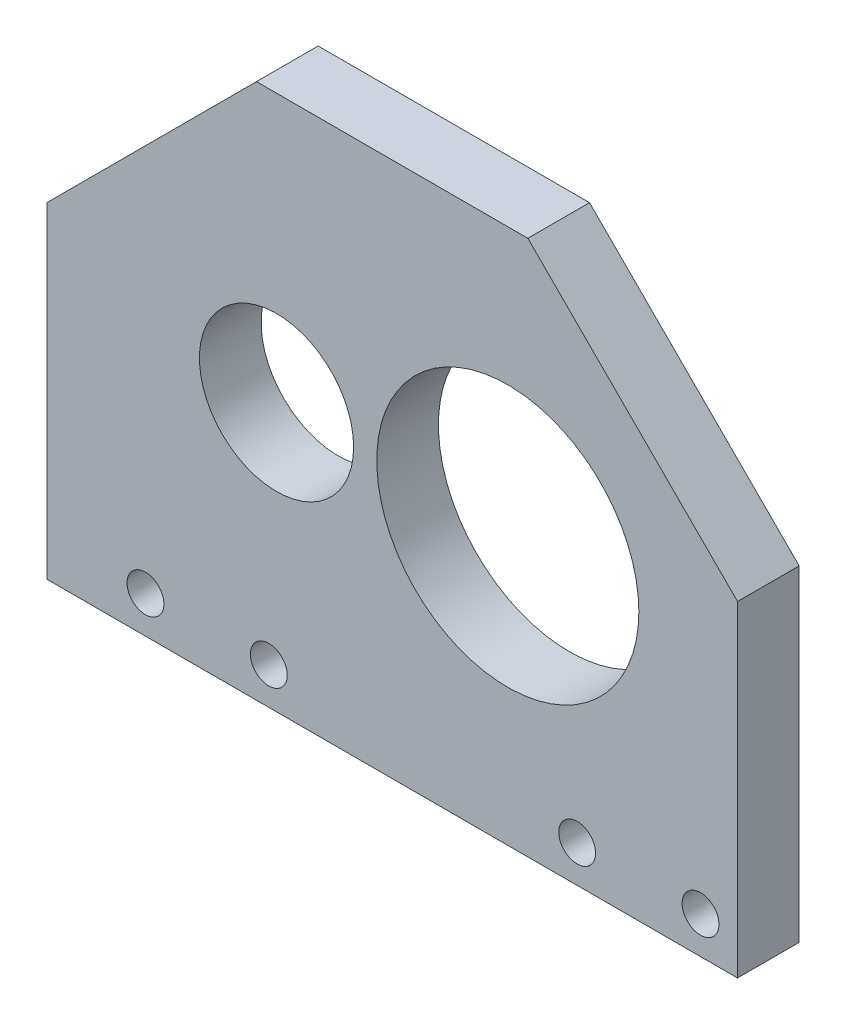
from build123d import *

# Parameters (mm, degrees)
SKETCH1_W             = 71.12
SKETCH1_H             = 55.16372
SKETCH1_R             = 13.49375
SKETCH1_R_2           = 7.9375
BOSS_EXTRUDE1_DEPTH   = 6.35
F_6_CLEARANCE_HOLE1_D = 3.7973
CUT_EXTRUDE1_DEPTH    = 46.448818478


with BuildPart() as part:
    # Sketch1 → Boss-Extrude1 (new body)
    with BuildSketch(Plane.XY):
        Rectangle(SKETCH1_W, SKETCH1_H)
        with Locations((11.90625, 0)):
            Circle(SKETCH1_R, mode=Mode.SUBTRACT)
        with Locations((-11.90625, 0)):
            Circle(SKETCH1_R_2, mode=Mode.SUBTRACT)
    extrude(amount=BOSS_EXTRUDE1_DEPTH)

    # #6 Clearance Hole1 (through all)
    with Locations(Plane.XY.offset(6.35)):
        with Locations((-25.4, -23.77186), (-12.7, -23.77186), (19.05, -23.77186), (31.75, -23.77186)):
            Hole(F_6_CLEARANCE_HOLE1_D / 2)

    # Sketch4 → Cut-Extrude1 (cut, through all)
    with BuildSketch(Plane.XY.offset(6.35)):
        Polygon((-35.56, 5.99186), (-13.97, 27.58186), (-35.56, 27.58186), align=None)
        Polygon((35.56, 5.99186), (13.97, 27.58186), (35.56, 27.58186), align=None)
    extrude(amount=-CUT_EXTRUDE1_DEPTH, mode=Mode.SUBTRACT)


solid = part.part
